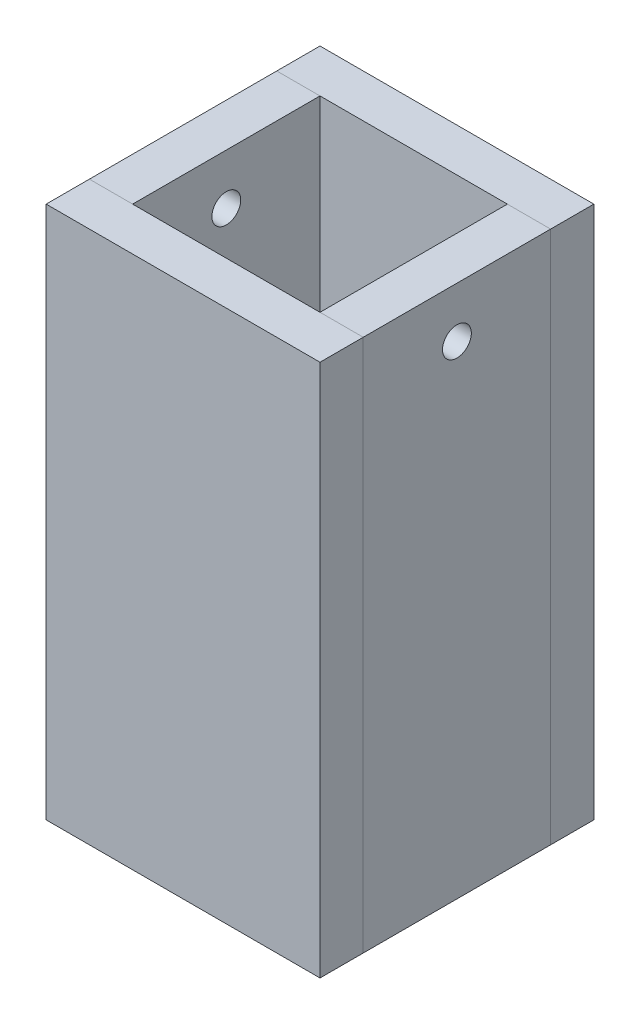
from build123d import *

# Parameters (mm, degrees)
ESBO_O1_W                  = 38
ESBO_O1_H                  = 6
RESSALTO_EXTRUS_O1_DEPTH   = 74
RESSALTO_EXTRUS_O1_2_DEPTH = 74
ESBO_O2_W                  = 6
ESBO_O2_H                  = 74
RESSALTO_EXTRUS_O2_DEPTH   = 26
RESSALTO_EXTRUS_O2_2_DEPTH = 26
CORTE_TUBO_START           = -38
ESBO_O3_R                  = 2
CORTE_TUBO_DEPTH           = 38


with BuildPart() as part:
    # Esboço1 → Ressalto-extrusão1 (new body)
    with BuildSketch(Plane(origin=(0, 0, 0), x_dir=(1, 0, 0), z_dir=(0, 1, 0))):
        with Locations((0, -16)):
            Rectangle(ESBO_O1_W, ESBO_O1_H)
    extrude(amount=RESSALTO_EXTRUS_O1_DEPTH)


with BuildPart() as body_2:
    # Esboço1 → Ressalto-extrus_o1 2 (new body)
    with BuildSketch(Plane(origin=(0, 0, 0), x_dir=(1, 0, 0), z_dir=(0, 1, 0))):
        with Locations((0, 16)):
            Rectangle(ESBO_O1_W, ESBO_O1_H)
    extrude(amount=RESSALTO_EXTRUS_O1_2_DEPTH)


with BuildPart() as body_3:
    # Esboço2 → Ressalto-extrusão2 (new body)
    with BuildSketch(Plane.XY.offset(-13)):
        with Locations((16, 37)):
            Rectangle(ESBO_O2_W, ESBO_O2_H)
    extrude(amount=RESSALTO_EXTRUS_O2_DEPTH)


with BuildPart() as body_4:
    # Esboço2 → Ressalto-extrus_o2 2 (new body)
    with BuildSketch(Plane.XY.offset(-13)):
        with Locations((-16, 37)):
            Rectangle(ESBO_O2_W, ESBO_O2_H)
    extrude(amount=RESSALTO_EXTRUS_O2_2_DEPTH)


with BuildPart() as corte_tubo_tool:
    # Esboço3 → Corte_tubo (new body)
    with BuildSketch(Plane(origin=(19, 0, 0), x_dir=(0, 0, -1), z_dir=(1, 0, 0)).offset(CORTE_TUBO_START)):
        with Locations((0, 67)):
            Circle(ESBO_O3_R)
    extrude(amount=CORTE_TUBO_DEPTH)


with BuildPart() as body_3_1:
    add(body_3.part)

    # Corte_tubo: cut by corte_tubo_tool
    add(corte_tubo_tool.part, mode=Mode.SUBTRACT)


with BuildPart() as body_4_1:
    add(body_4.part)

    # Corte_tubo: cut by corte_tubo_tool
    add(corte_tubo_tool.part, mode=Mode.SUBTRACT)


solid = Compound([part.part, body_2.part, body_3_1.part, body_4_1.part])
